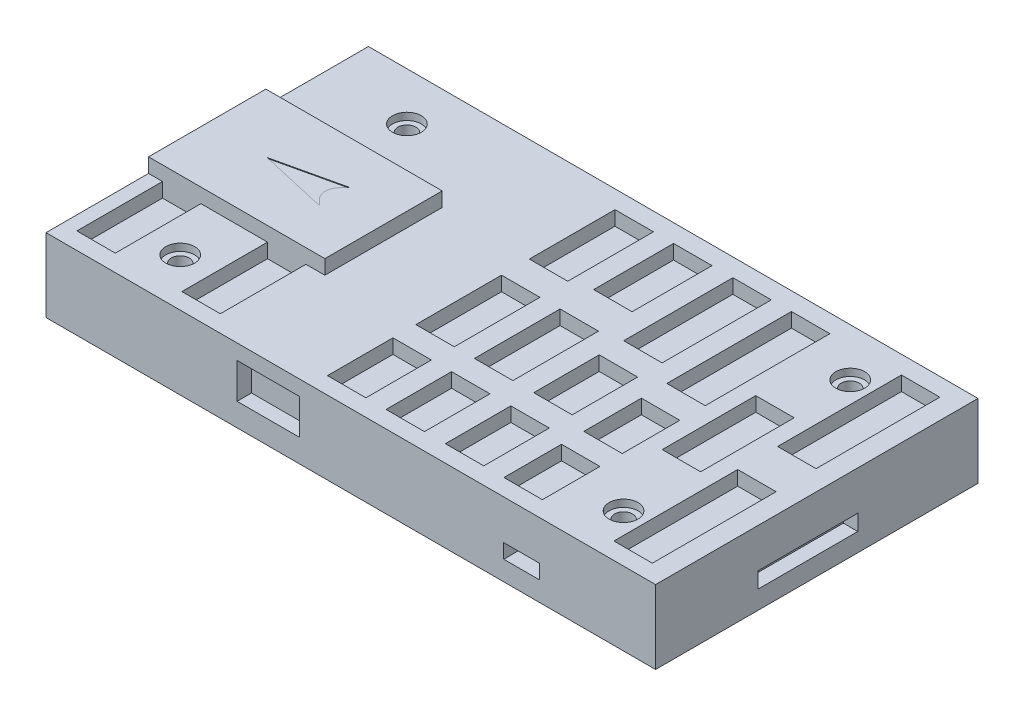
from build123d import *

# Parameters (mm, degrees)
SKETCH1_W           = 84.7
SKETCH1_H           = 44.8
BOSS_EXTRUDE1_DEPTH = 10.22
SKETCH2_W           = 24.5
SKETCH2_H           = 16.3
BOSS_EXTRUDE2_DEPTH = 2
SKETCH3_W           = 5.34
SKETCH3_H           = 11.9
SKETCH3_H_2         = 9.1
SKETCH3_H_3         = 8
SKETCH3_H_4         = 17.2
SKETCH3_H_5         = 11.1
SKETCH3_H_6         = 15.17
SKETCH3_H_7         = 17.32
SKETCH3_H_8         = 13
CUT_EXTRUDE1_DEPTH  = 2
SKETCH4_R           = 1.25
CUT_EXTRUDE2_DEPTH  = 50.443006583
SKETCH5_R           = 2
CUT_EXTRUDE3_DEPTH  = 1
SKETCH6_W           = 8.64
SKETCH6_H           = 4.92
CUT_EXTRUDE4_DEPTH  = 2
SKETCH7_W           = 5
SKETCH7_H           = 2
CUT_EXTRUDE5_DEPTH  = 2
SKETCH8_W           = 20.33
SKETCH8_H           = 3.1
SKETCH8_W_2         = 5.5
SKETCH8_H_2         = 2
CUT_EXTRUDE6_DEPTH  = 2
SKETCH9_W           = 13.9
SKETCH9_H           = 2.2
CUT_EXTRUDE7_DEPTH  = 2
CUT_EXTRUDE8_DEPTH  = 0.1


with BuildPart() as part:
    # Sketch1 → Boss-Extrude1 (new body)
    with BuildSketch(Plane(origin=(0, 0, 0), x_dir=(1, 0, 0), z_dir=(0, 1, 0))):
        Rectangle(SKETCH1_W, SKETCH1_H)
    extrude(amount=BOSS_EXTRUDE1_DEPTH)

    # Sketch2 → Boss-Extrude2 (add)
    with BuildSketch(Plane(origin=(0, 10.22, 0), x_dir=(1, 0, 0), z_dir=(0, 1, 0))):
        with Locations((-30.1, 0)):
            Rectangle(SKETCH2_W, SKETCH2_H)
    extrude(amount=BOSS_EXTRUDE2_DEPTH)

    # Sketch3 → Cut-Extrude1 (cut)
    with BuildSketch(Plane(origin=(0, 10.22, 0), x_dir=(1, 0, 0), z_dir=(0, 1, 0))):
        with Locations((-37.74, -14.1)):
            Rectangle(SKETCH3_W, SKETCH3_H)
        with Locations((-23.15, -14.1)):
            Rectangle(SKETCH3_W, SKETCH3_H)
        with Locations((-2.92, -15.5)):
            Rectangle(SKETCH3_W, SKETCH3_H_2)
        with Locations((5.22, -15.5)):
            Rectangle(SKETCH3_W, SKETCH3_H_2)
        with Locations((13.46, -15.5)):
            Rectangle(SKETCH3_W, SKETCH3_H_2)
        with Locations((21.6, -16.05)):
            Rectangle(SKETCH3_W, SKETCH3_H_3)
        with Locations((21.6, -4.95)):
            Rectangle(SKETCH3_W, SKETCH3_H_3)
        with Locations((36.88, -11.45)):
            Rectangle(SKETCH3_W, SKETCH3_H_4)
        with Locations((-2.92, -1.82)):
            Rectangle(SKETCH3_W, SKETCH3_H)
        with Locations((5.22, -1.82)):
            Rectangle(SKETCH3_W, SKETCH3_H)
        with Locations((13.46, -3.22)):
            Rectangle(SKETCH3_W, SKETCH3_H_2)
        with Locations((-2.92, 13.95)):
            Rectangle(SKETCH3_W, SKETCH3_H)
        with Locations((5.22, 14.35)):
            Rectangle(SKETCH3_W, SKETCH3_H_5)
        with Locations((13.46, 12.315)):
            Rectangle(SKETCH3_W, SKETCH3_H_6)
        with Locations((21.6, 11.24)):
            Rectangle(SKETCH3_W, SKETCH3_H_7)
        with Locations((29.24, 0.8)):
            Rectangle(SKETCH3_W, SKETCH3_H_8)
        with Locations((36.88, 11.3)):
            Rectangle(SKETCH3_W, SKETCH3_H_4)
    extrude(amount=-CUT_EXTRUDE1_DEPTH, mode=Mode.SUBTRACT)

    # Sketch4 → Cut-Extrude2 (cut, through all)
    with BuildSketch(Plane.XZ):
        with Locations(Location((-30.35, 15.75, 0), (0, 0, 270))):
            Circle(SKETCH4_R)
        with Locations(Location((31.25, 15.75, 0), (0, 0, 270))):
            Circle(SKETCH4_R)
        with Locations(Location((31.25, -15.75, 0), (0, 0, 270))):
            Circle(SKETCH4_R)
        with Locations(Location((-30.35, -15.75, 0), (0, 0, 270))):
            Circle(SKETCH4_R)
    extrude(amount=-CUT_EXTRUDE2_DEPTH, mode=Mode.SUBTRACT)

    # Sketch5 → Cut-Extrude3 (cut)
    with BuildSketch(Plane(origin=(0, 10.22, 0), x_dir=(1, 0, 0), z_dir=(0, 1, 0))):
        with Locations(Location((-30.35, 15.75, 0), (0, 0, 270))):
            Circle(SKETCH5_R)
        with Locations(Location((-30.35, -15.75, 0), (0, 0, 270))):
            Circle(SKETCH5_R)
        with Locations(Location((31.25, 15.75, 0), (0, 0, 270))):
            Circle(SKETCH5_R)
        with Locations(Location((31.25, -15.75, 0), (0, 0, 270))):
            Circle(SKETCH5_R)
    extrude(amount=-CUT_EXTRUDE3_DEPTH, mode=Mode.SUBTRACT)

    # Sketch6 → Cut-Extrude4 (cut)
    with BuildSketch(Plane.XY.offset(22.4)):
        with Locations((-11.48, 5.66)):
            Rectangle(SKETCH6_W, SKETCH6_H)
    extrude(amount=-CUT_EXTRUDE4_DEPTH, mode=Mode.SUBTRACT)

    # Sketch7 → Cut-Extrude5 (cut)
    with BuildSketch(Plane.XY.offset(22.4)):
        with Locations((23.75, 3.72)):
            Rectangle(SKETCH7_W, SKETCH7_H)
    extrude(amount=-CUT_EXTRUDE5_DEPTH, mode=Mode.SUBTRACT)

    # Sketch8 → Cut-Extrude6 (cut)
    with BuildSketch(Plane(origin=(0, 0, -22.4), x_dir=(-1, 0, 0), z_dir=(0, 0, -1))):
        with Locations((-2.885, 3.3)):
            Rectangle(SKETCH8_W, SKETCH8_H)
        with Locations((-23.2, 3.72)):
            Rectangle(SKETCH8_W_2, SKETCH8_H_2)
    extrude(amount=-CUT_EXTRUDE6_DEPTH, mode=Mode.SUBTRACT)

    # Sketch9 → Cut-Extrude7 (cut)
    with BuildSketch(Plane(origin=(42.35, 0, 0), x_dir=(0, 0, -1), z_dir=(1, 0, 0))):
        with Locations((-1.25, 3.66)):
            Rectangle(SKETCH9_W, SKETCH9_H)
    extrude(amount=-CUT_EXTRUDE7_DEPTH, mode=Mode.SUBTRACT)

    # Sketch10 → Cut-Extrude8 (cut)
    with BuildSketch(Plane(origin=(0, 12.22, 0), x_dir=(1, 0, 0), z_dir=(0, 1, 0))):
        with BuildLine():
            Line((-34.034433703, 0), (-24.634433703, 2.15))
            Line((-24.634433703, 2.15), (-25.369176186, 1.392199815))
            ThreePointArc((-25.369176186, 1.392199815), (-25.933286331, 0), (-25.369176186, -1.392199815))
            Line((-25.369176186, -1.392199815), (-24.634433703, -2.15))
            Line((-24.634433703, -2.15), (-34.034433703, 0))
        make_face()
    extrude(amount=-CUT_EXTRUDE8_DEPTH, mode=Mode.SUBTRACT)


solid = part.part
